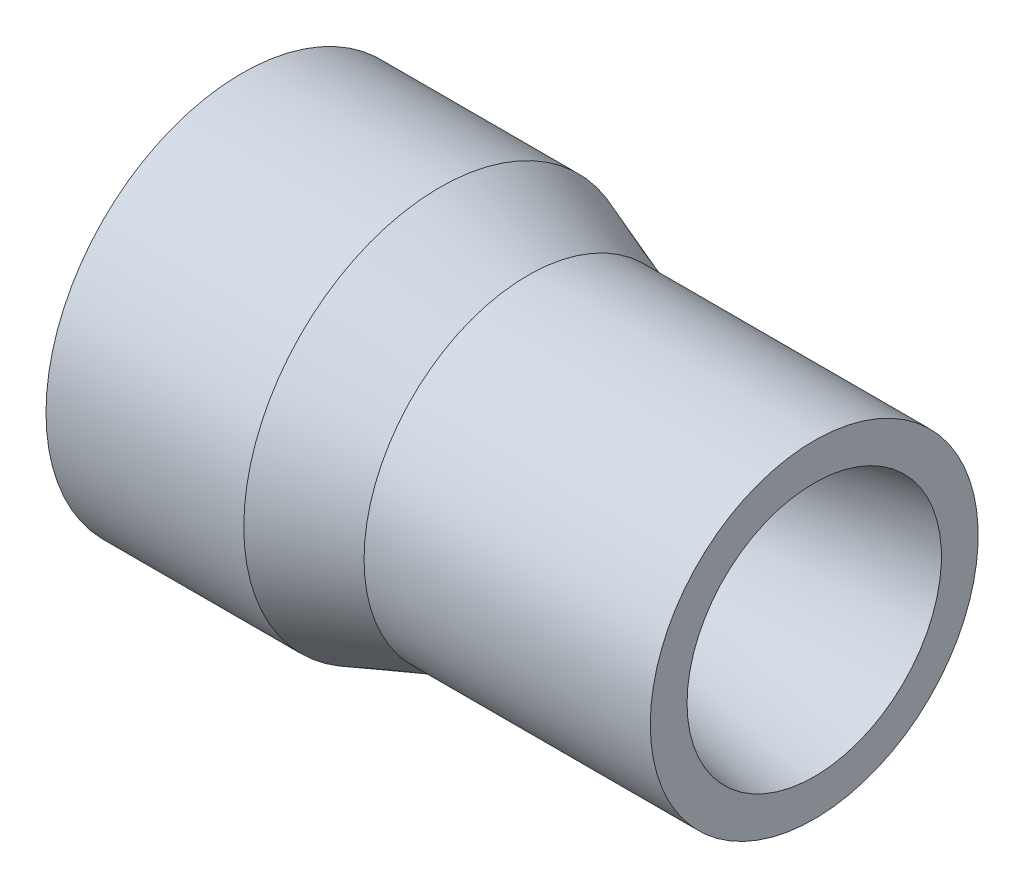
from build123d import *


with BuildPart() as part:
    # Sketch1 → Revolve1 (revolve)
    with BuildSketch(Plane.XY, mode=Mode.PRIVATE) as revolve1_sk:
        with BuildLine():
            Line((42.945252988, 29.825549705), (62.812385376, 18.355255472))
            ThreePointArc((62.812385376, 18.355255472), (68.271514292, 16.084070702), (74.13, 15.285))
            ThreePointArc((74.13, 15.285), (75.042634026, 15.351014858), (75.933754417, 15.558772587))
            add(Edge.make_bspline(
                [(75.933754417, 15.558772587), (97.124186968, 22.913189408), (126.012294015, 29.837045564), (148.34, 32.975)],
                knots=[0, 0, 0, 0, 1, 1, 1, 1], degree=3))
            Line((148.34, 32.975), (148.34, 42.5))
            Line((148.34, 42.5), (74.13, 42.5))
            Line((74.13, 42.5), (51.27098787, 50.82))
            Line((51.27098787, 50.82), (0, 50.82))
            Line((0, 50.82), (0, 41.295))
            ThreePointArc((0, 41.295), (22.230006991, 38.396147211), (42.945252988, 29.825549705))
        make_face()
    revolve(revolve1_sk.sketch.rotate(Axis((0, 0, 0), (1, 0, 0)), 90), axis=Axis((0, 0, 0), (1, 0, 0)))


solid = part.part
